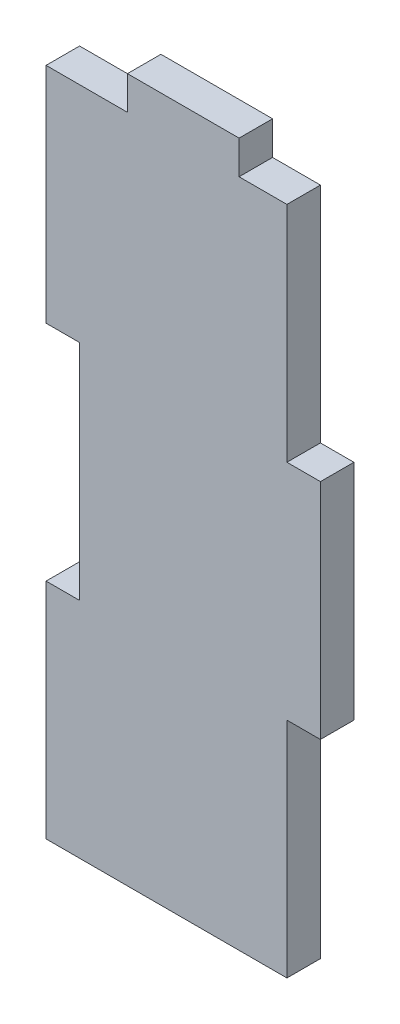
from build123d import *

# Parameters (mm, degrees)
PLATE_THICKNESS_3MM_DEPTH = 3
SKETCH_1_W                = 3.5
SKETCH_1_H                = 3
EXTRUDE_2_DEPTH           = 3


with BuildPart() as part:
    # Sketch1 → Plate_thickness_3mm (new body)
    with BuildSketch(Plane.XY):
        Polygon((21.57, 0), (0, 0), (0, 20), (3, 20), (3, 40), (0, 40), (0, 60), (10.785, 60), (10.785, 63), (13.785, 63), (13.785, 60), (21.57, 60), (21.57, 40), (24.57, 40), (24.57, 20), (21.57, 20), align=None)
    extrude(amount=PLATE_THICKNESS_3MM_DEPTH)

    # 草图1 → 凸台-拉伸2 (add)
    with BuildSketch(Plane.XY.offset(3)):
        with Locations((9.035, 61.5)):
            Rectangle(SKETCH_1_W, SKETCH_1_H)
        with Locations((15.535, 61.5)):
            Rectangle(SKETCH_1_W, SKETCH_1_H)
    extrude(amount=-EXTRUDE_2_DEPTH)


solid = part.part
